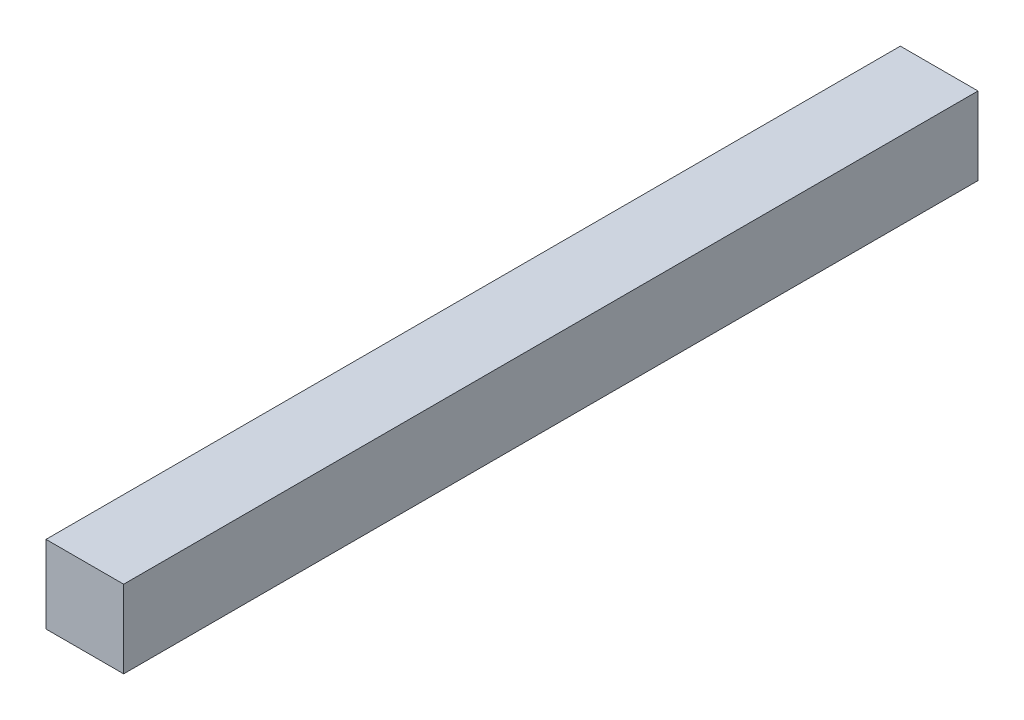
from build123d import *

# Parameters (mm, degrees)
SKETCH1_W           = 30
SKETCH1_H           = 30
BOSS_EXTRUDE1_DEPTH = 165


with BuildPart() as part:
    # Sketch1 → Boss-Extrude1 (new, symmetric)
    with BuildSketch(Plane.XY):
        Rectangle(SKETCH1_W, SKETCH1_H)
    extrude(amount=BOSS_EXTRUDE1_DEPTH, both=True)


solid = part.part
